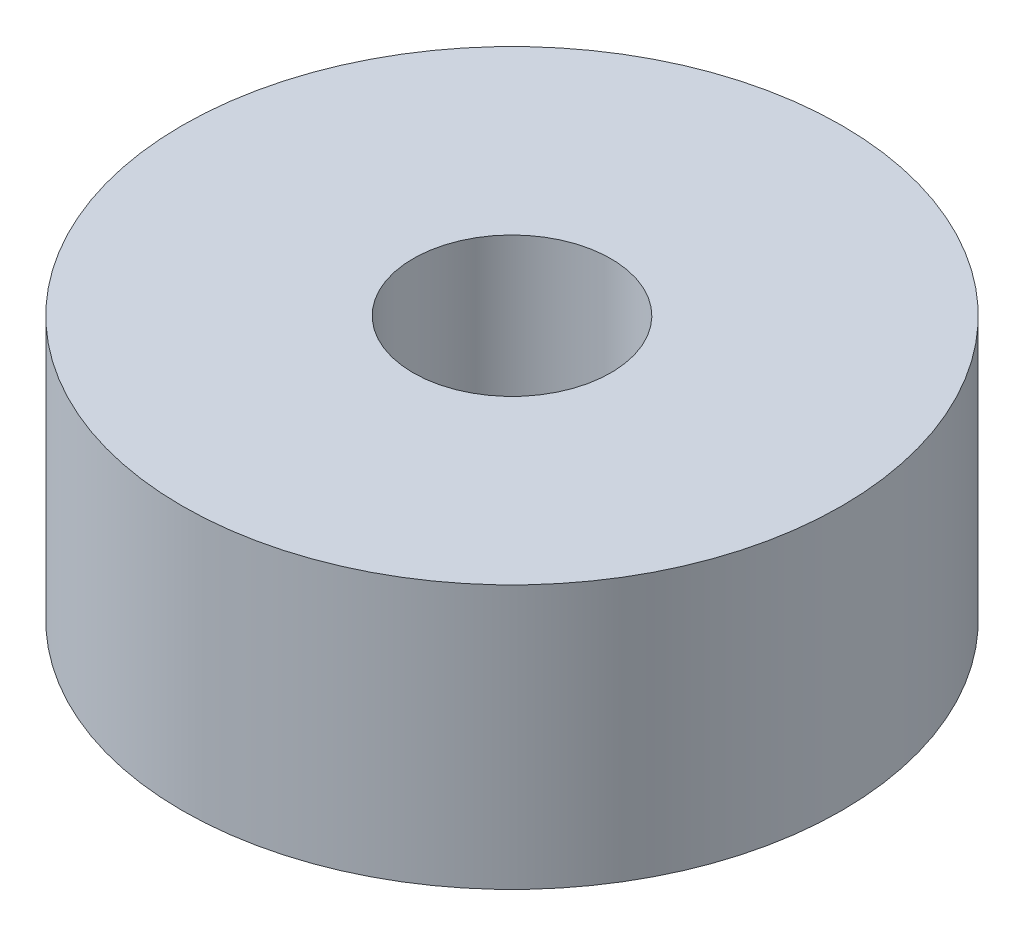
from build123d import *

# Parameters (mm, degrees)
SKETCH1_R           = 5
SKETCH1_R_2         = 1.5
BOSS_EXTRUDE1_DEPTH = 4


with BuildPart() as part:
    # Sketch1 → Boss-Extrude1 (new body)
    with BuildSketch(Plane(origin=(0, 0, 0), x_dir=(1, 0, 0), z_dir=(0, 1, 0))):
        with Locations(Location((0, 0, 0), (0, 0, 270))):
            Circle(SKETCH1_R)
        with Locations(Location((0, 0, 0), (0, 0, 270))):
            Circle(SKETCH1_R_2, mode=Mode.SUBTRACT)
    extrude(amount=BOSS_EXTRUDE1_DEPTH)


solid = part.part
